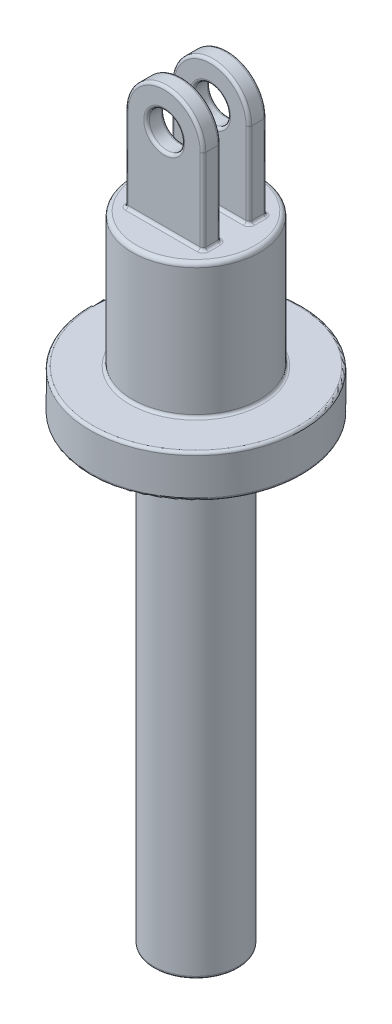
from build123d import *

# Parameters (mm, degrees)
BOSS_EXTRUDE2_START = 1
SKETCH2_R           = 1.25
BOSS_EXTRUDE2_DEPTH = 1.25
BOSS_EXTRUDE3_START = -2.25
SKETCH2_2_R         = 1.25
BOSS_EXTRUDE3_DEPTH = 1.25
FILLET1_R           = 0.3
SKETCH4_R           = 1.25
CUT_EXTRUDE1_DEPTH  = 32.5
FILLET2_R           = 0.2
FILLET3_R           = 0.2


with BuildPart() as part:
    # Sketch1 → Revolve1 (revolve)
    with BuildSketch(Plane.XY):
        Polygon((0, 0), (0, 45), (-4.5, 45), (-4.5, 35.5), (-7.5, 35.5), (-7.5, 32.5), (-3, 32.5), (-3, 0), align=None)
    revolve(axis=Axis((0, 0, 0), (0, 1, 0)))

    # Sketch2 → Boss-Extrude2 (add)
    with BuildSketch(Plane.XY.offset(BOSS_EXTRUDE2_START)):
        with BuildLine():
            Line((2.75, 51), (2.75, 45))
            Line((2.75, 45), (-2.75, 45))
            Line((-2.75, 45), (-2.75, 51))
            ThreePointArc((-2.75, 51), (0, 53.75), (2.75, 51))
        make_face()
        with Locations((0, 51)):
            Circle(SKETCH2_R, mode=Mode.SUBTRACT)
    extrude(amount=BOSS_EXTRUDE2_DEPTH)

    # Sketch2<2> → Boss-Extrude3 (add)
    with BuildSketch(Plane.XY.offset(BOSS_EXTRUDE3_START)):
        with BuildLine():
            Line((2.75, 51), (2.75, 45))
            Line((2.75, 45), (-2.75, 45))
            Line((-2.75, 45), (-2.75, 51))
            ThreePointArc((-2.75, 51), (0, 53.75), (2.75, 51))
        make_face()
        with Locations((0, 51)):
            Circle(SKETCH2_2_R, mode=Mode.SUBTRACT)
    extrude(amount=BOSS_EXTRUDE3_DEPTH)

    # Fillet1
    fillet1_edges = [part.edges().sort_by_distance(p)[0] for p in [
        (4.5, 45, 0),
    ]]
    fillet(fillet1_edges, radius=FILLET1_R)

    # Sketch4 → Cut-Extrude1 (cut)
    with BuildSketch(Plane.XZ):
        Circle(SKETCH4_R)
    extrude(amount=-CUT_EXTRUDE1_DEPTH, mode=Mode.SUBTRACT)

    # Fillet2
    fillet2_edges = [part.edges().sort_by_distance(p)[0] for p in [
        (-1.25, 51, 1),
        (-1.25, 51, 2.25),
        (0, 53.75, 1),
        (-2.75, 48, 1),
        (0, 45, 1),
        (0, 53.75, 2.25),
        (-2.75, 48, 2.25),
        (0, 45, 2.25),
        (2.75, 48, 2.25),
        (2.75, 45, 1.625),
        (-2.75, 45, 1.625),
        (2.75, 48, 1),
        (-1.25, 51, -1),
        (-1.25, 51, -2.25),
        (0, 53.75, -1),
        (-2.75, 48, -1),
        (0, 45, -1),
        (2.75, 48, -1),
        (0, 53.75, -2.25),
        (-2.75, 48, -2.25),
        (0, 45, -2.25),
        (-2.75, 45, -1.625),
        (2.75, 45, -1.625),
        (2.75, 48, -2.25),
    ]]
    fillet(fillet2_edges, radius=FILLET2_R)

    # Fillet3
    fillet3_edges = [part.edges().sort_by_distance(p)[0] for p in [
        (3, 0, 0),
        (-1.25, 0, 0),
        (3, 32.5, 0),
        (7.5, 32.5, 0),
        (4.5, 35.5, 0),
        (7.5, 35.5, 0),
    ]]
    fillet(fillet3_edges, radius=FILLET3_R)


solid = part.part
